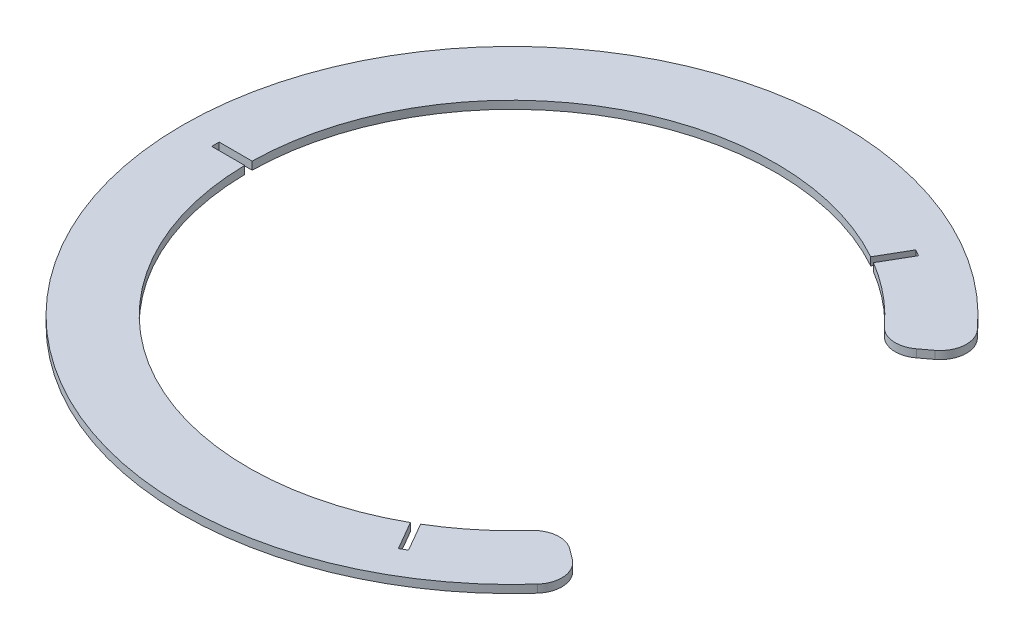
from build123d import *

# Parameters (mm, degrees)
SKETCH1_R           = 125
BOSS_EXTRUDE1_DEPTH = 3
SKETCH2_R           = 100
CUT_EXTRUDE1_DEPTH  = 3
SKETCH3_W           = 25
SKETCH3_H           = 2.83
CUT_EXTRUDE2_DEPTH  = 3
CIRPATTERN1_COUNT   = 3
CUT_EXTRUDE3_DEPTH  = 3
FILLET1_R           = 10


with BuildPart() as part:
    # Sketch1 → Boss-Extrude1 (new body)
    with BuildSketch(Plane(origin=(0, 0, 0), x_dir=(1, 0, 0), z_dir=(0, 1, 0))):
        with Locations(Location((0, 0, 0), (0, 0, 270))):
            Circle(SKETCH1_R)
    extrude(amount=BOSS_EXTRUDE1_DEPTH)

    # Sketch2 → Cut-Extrude1 (cut)
    with BuildSketch(Plane(origin=(0, 3, 0), x_dir=(1, 0, 0), z_dir=(0, 1, 0))):
        with Locations(Location((0, 0, 0), (0, 0, 270))):
            Circle(SKETCH2_R)
    extrude(amount=-CUT_EXTRUDE1_DEPTH, mode=Mode.SUBTRACT)

    # Sketch3 → Cut-Extrude2 (cut)
    with BuildSketch(Plane(origin=(0, 3, 0), x_dir=(1, 0, 0), z_dir=(0, 1, 0))):
        with Locations((-100, 0)):
            Rectangle(SKETCH3_W, SKETCH3_H)
    cut_extrude2 = extrude(amount=-CUT_EXTRUDE2_DEPTH, mode=Mode.SUBTRACT)

    # CirPattern1: Cut-Extrude2 ×3 about axis
    cirpattern1_axis = Axis((0, 0, 0), (0, 1, 0))
    for i in range(1, CIRPATTERN1_COUNT):
        add(cut_extrude2.rotate(cirpattern1_axis, i * 360 / CIRPATTERN1_COUNT), mode=Mode.SUBTRACT)

    # Sketch4 → Cut-Extrude3 (cut)
    with BuildSketch(Plane(origin=(0, 3, 0), x_dir=(1, 0, 0), z_dir=(0, 1, 0))):
        with BuildLine():
            Line((80, -60), (99.982550279, -75.023260657))
            ThreePointArc((99.982550279, -75.023260657), (124.999999154, -0.014539179), (100, 75))
            Line((100, 75), (80, 60))
            ThreePointArc((80, 60), (100, 0), (80, -60))
        make_face()
    extrude(amount=-CUT_EXTRUDE3_DEPTH, mode=Mode.SUBTRACT)

    # Fillet1
    fillet1_edges = [part.edges().sort_by_distance(p)[0] for p in [
        (80, 1.5, 60),
        (80, 1.5, -60),
        (100, 1.5, -75),
        (99.982550279, 1.5, 75.023260657),
    ]]
    fillet(fillet1_edges, radius=FILLET1_R)


solid = part.part
